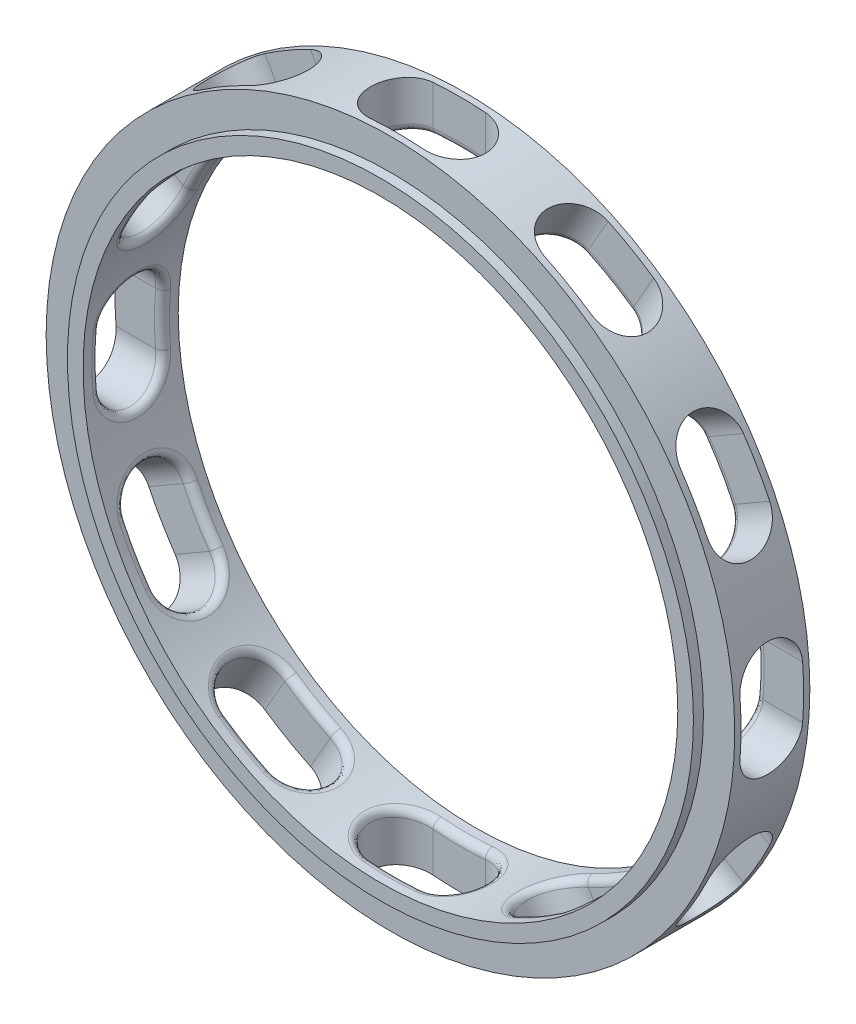
from build123d import *

# Parameters (mm, degrees)
SKETCH1_R           = 34.925
SKETCH1_R_2         = 30.1625
BASE_EXTRUDE_DEPTH  = 3.81
SKETCH2_R           = 31.75
SKETCH2_R_2         = 30.1625
BOSS_EXTRUDE1_DEPTH = 1.016
BOSS_EXTRUDE2_START = 1.016
SKETCH3_R           = 31.75
SKETCH3_R_2         = 30.1625
BOSS_EXTRUDE2_DEPTH = 1.016
CUT_EXTRUDE1_DEPTH  = 12.7
CIRPATTERN5_COUNT   = 12
FILLET1_R           = 0.762


with BuildPart() as part:
    # Sketch1 → Base-Extrude (new, symmetric)
    with BuildSketch(Plane.XY):
        Circle(SKETCH1_R)
        Circle(SKETCH1_R_2, mode=Mode.SUBTRACT)
    extrude(amount=BASE_EXTRUDE_DEPTH, both=True)

    # Sketch2 → Boss-Extrude1 (add)
    with BuildSketch(Plane.XY.offset(3.81)):
        Circle(SKETCH2_R)
        Circle(SKETCH2_R_2, mode=Mode.SUBTRACT)
    extrude(amount=BOSS_EXTRUDE1_DEPTH)

    # Sketch3 → Boss-Extrude2 (add)
    with BuildSketch(Plane(origin=(-15.972499489, 20.746024167, -3.81), x_dir=(-1, 0, 0), z_dir=(0, 0, -1)).offset(BOSS_EXTRUDE2_START)):
        with Locations(Location((-15.972499489, -20.746024167, 0), (0, 0, 180))):
            Circle(SKETCH3_R)
        with Locations(Location((-15.972499489, -20.746024167, 0), (0, 0, 180))):
            Circle(SKETCH3_R_2, mode=Mode.SUBTRACT)
    extrude(amount=-BOSS_EXTRUDE2_DEPTH)

    # Sketch4 → Cut-Extrude1 (cut)
    with BuildSketch(Plane(origin=(0, 38.1, 0), x_dir=(-1, 0, 0), z_dir=(0, 1, 0))):
        with BuildLine():
            Line((2.667, -3.175), (-2.667, -3.175))
            ThreePointArc((-2.667, -3.175), (-5.842, 0), (-2.667, 3.175))
            Line((-2.667, 3.175), (2.667, 3.175))
            ThreePointArc((2.667, 3.175), (5.842, 0), (2.667, -3.175))
        make_face()
    cut_extrude1 = extrude(amount=-CUT_EXTRUDE1_DEPTH, mode=Mode.SUBTRACT)

    # CirPattern5: Cut-Extrude1 ×12 about axis
    cirpattern5_axis = Axis((0, 0, -53.81), (0, 0, 1))
    for i in range(1, CIRPATTERN5_COUNT):
        add(cut_extrude1.rotate(cirpattern5_axis, i * 360 / CIRPATTERN5_COUNT), mode=Mode.SUBTRACT)

    # Fillet1
    fillet1_edges = [part.edges().sort_by_distance(p)[0] for p in [
        (30.132950315, -1.334807688, -3.175),
        (30.132950315, 1.334807688, -3.175),
        (30.132950315, 1.334807688, 3.175),
        (30.132950315, -1.334807688, 3.175),
        (26.121491242, 15.08125, -3.175),
        (26.121491242, 15.08125, 3.175),
        (15.08125, 26.121491242, -3.175),
        (15.08125, 26.121491242, 3.175),
        (0, 30.1625, -3.175),
        (0, 30.1625, 3.175),
        (-15.08125, 26.121491242, -3.175),
        (-15.08125, 26.121491242, 3.175),
        (-26.121491242, 15.08125, -3.175),
        (-26.121491242, 15.08125, 3.175),
        (-30.1625, 0, -3.175),
        (-30.1625, 0, 3.175),
        (-26.121491242, -15.08125, -3.175),
        (-26.121491242, -15.08125, 3.175),
        (-15.08125, -26.121491242, -3.175),
        (-15.08125, -26.121491242, 3.175),
        (0, -30.1625, -3.175),
        (0, -30.1625, 3.175),
        (15.08125, -26.121491242, -3.175),
        (15.08125, -26.121491242, 3.175),
        (26.121491242, -15.08125, -3.175),
        (26.121491242, -15.08125, 3.175),
    ]]
    fillet(fillet1_edges, radius=FILLET1_R)


solid = part.part
